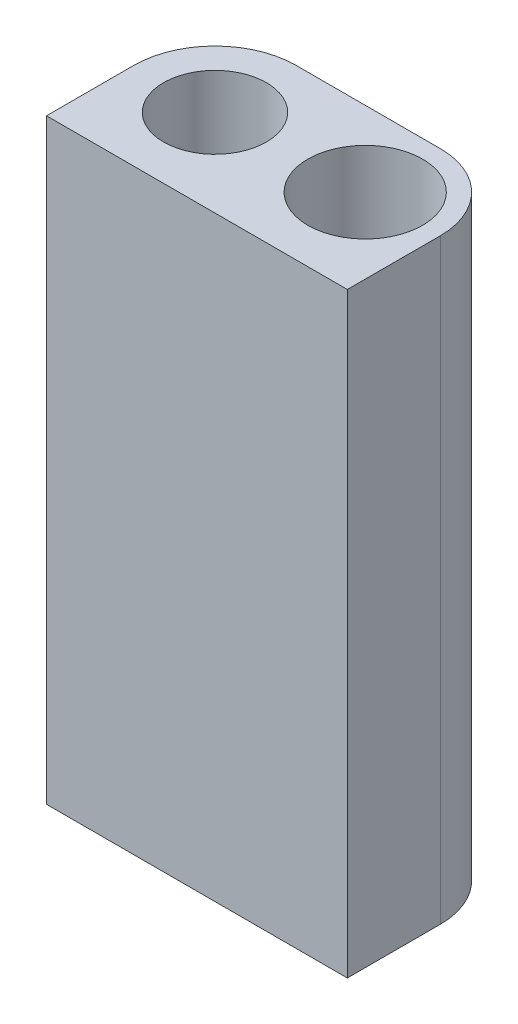
from build123d import *

# Parameters (mm, degrees)
SKETCH1_R           = 3.85
BOSS_EXTRUDE2_DEPTH = 40


with BuildPart() as part:
    # Sketch1 → Boss-Extrude2 (new body)
    # profile 1 of 2: a face of its own
    with BuildSketch(Plane(origin=(0, 0, 0), x_dir=(1, 0, 0), z_dir=(0, 1, 0))):
        with BuildLine():
            ThreePointArc((0, 5.45), (-3.853731957, 3.853731957), (-5.45, 0))
            Line((-5.45, 0), (-3.45, 0))
            ThreePointArc((-3.45, 0), (0, 3.45), (3.45, 0))
            ThreePointArc((3.45, 0), (2.439518395, -2.439518395), (0, -3.45))
            Line((0, -3.45), (0, -5.85))
            Line((0, -5.85), (5.45, -5.85))
            Line((5.45, -5.85), (14.7291644, -5.85))
            Line((14.7291644, -5.85), (14.7291644, 0.4))
            ThreePointArc((14.7291644, 0.4), (13.250053645, 3.970889245), (9.6791644, 5.45))
            Line((9.6791644, 5.45), (0, 5.45))
        make_face()
        with Locations(Location((9.6791644, 0.4, 0), (0, 0, 270))):
            Circle(SKETCH1_R, mode=Mode.SUBTRACT)
    # profile 2 of 2: a face of its own
    with BuildSketch(Plane(origin=(0, 0, 0), x_dir=(1, 0, 0), z_dir=(0, 1, 0))):
        with BuildLine():
            Line((-3.45, 0), (-5.45, 0))
            Line((-5.45, 0), (-5.45, -5.85))
            Line((-5.45, -5.85), (0, -5.85))
            Line((0, -5.85), (0, -3.45))
            ThreePointArc((0, -3.45), (-2.439518395, -2.439518395), (-3.45, 0))
        make_face()
    extrude(amount=BOSS_EXTRUDE2_DEPTH)


solid = part.part
